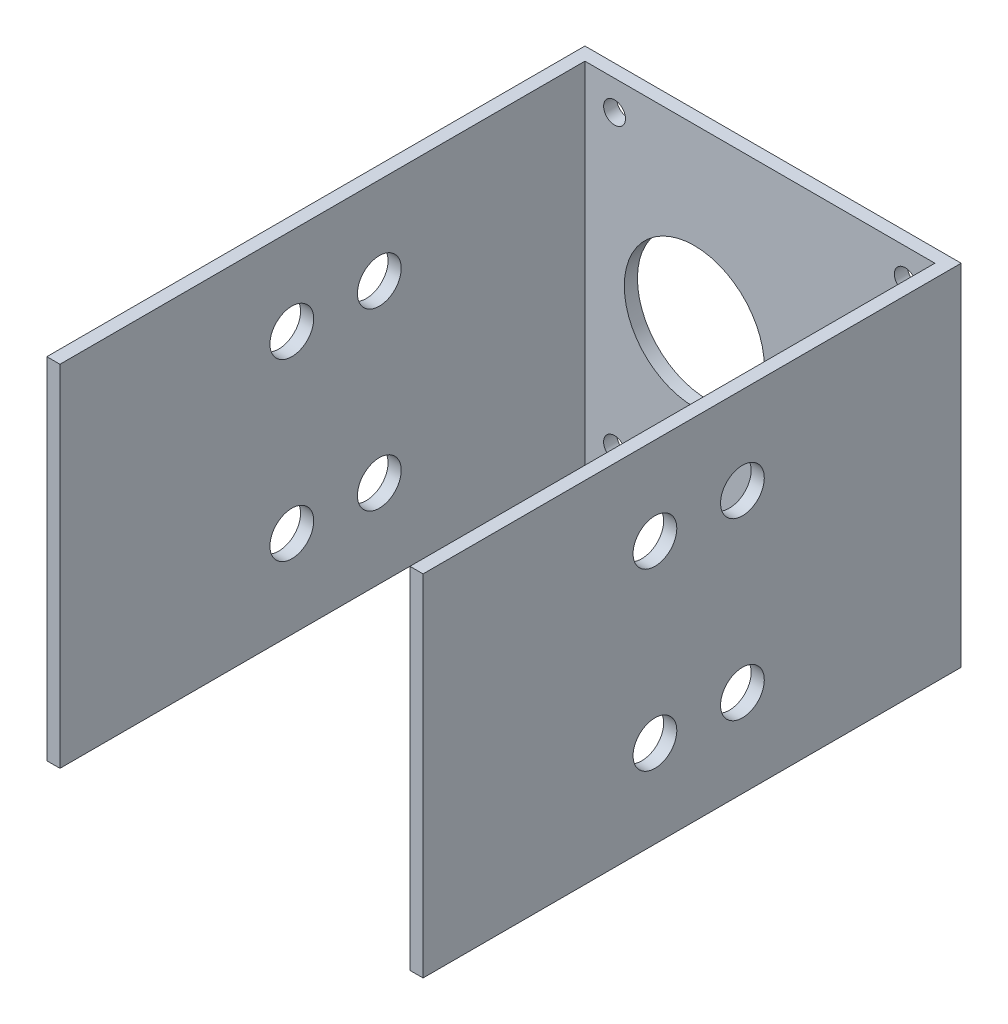
from build123d import *

# Parameters (mm, degrees)
SKETCH1_W           = 86
SKETCH1_H           = 80
BOSS_EXTRUDE1_DEPTH = 3
SKETCH2_W           = 3
SKETCH2_H           = 80
BOSS_EXTRUDE2_DEPTH = 120
SKETCH3_R           = 16
CUT_EXTRUDE1_DEPTH  = 120
SKETCH4_R           = 2.5
CUT_EXTRUDE2_DEPTH  = 120
SKETCH5_R           = 5
CUT_EXTRUDE3_DEPTH  = 156.32224567


with BuildPart() as part:
    # Sketch1 → Boss-Extrude1 (new body)
    with BuildSketch(Plane.XY):
        Rectangle(SKETCH1_W, SKETCH1_H)
    extrude(amount=BOSS_EXTRUDE1_DEPTH)

    # Sketch2 → Boss-Extrude2 (add)
    with BuildSketch(Plane.XY.offset(3)):
        with Locations((-41.5, 0)):
            Rectangle(SKETCH2_W, SKETCH2_H)
        with Locations((41.5, 0)):
            Rectangle(SKETCH2_W, SKETCH2_H)
    extrude(amount=BOSS_EXTRUDE2_DEPTH)

    # Sketch3 → Cut-Extrude1 (cut)
    with BuildSketch(Plane(origin=(0, 0, 0), x_dir=(-1, 0, 0), z_dir=(0, 0, -1))):
        with Locations((15, 0)):
            Circle(SKETCH3_R)
    extrude(amount=-CUT_EXTRUDE1_DEPTH, mode=Mode.SUBTRACT)

    # Sketch4 → Cut-Extrude2 (cut)
    with BuildSketch(Plane(origin=(0, 0, 0), x_dir=(-1, 0, 0), z_dir=(0, 0, -1))):
        with Locations((-33.23, 33.23)):
            Circle(SKETCH4_R)
        with Locations((-33.23, -33.23)):
            Circle(SKETCH4_R)
        with Locations((33.23, -33.23)):
            Circle(SKETCH4_R)
        with Locations((33.23, 33.23)):
            Circle(SKETCH4_R)
    extrude(amount=-CUT_EXTRUDE2_DEPTH, mode=Mode.SUBTRACT)

    # Sketch5 → Cut-Extrude3 (cut, through all)
    with BuildSketch(Plane(origin=(43, 0, 0), x_dir=(0, 0, -1), z_dir=(1, 0, 0))):
        with Locations(Location((-50, 20, 0), (0, 0, 90))):
            Circle(SKETCH5_R)
        with Locations(Location((-50, -20, 0), (0, 0, 90))):
            Circle(SKETCH5_R)
        with Locations(Location((-70, 20, 0), (0, 0, 90))):
            Circle(SKETCH5_R)
        with Locations(Location((-70, -20, 0), (0, 0, 90))):
            Circle(SKETCH5_R)
    extrude(amount=-CUT_EXTRUDE3_DEPTH, mode=Mode.SUBTRACT)


solid = part.part
